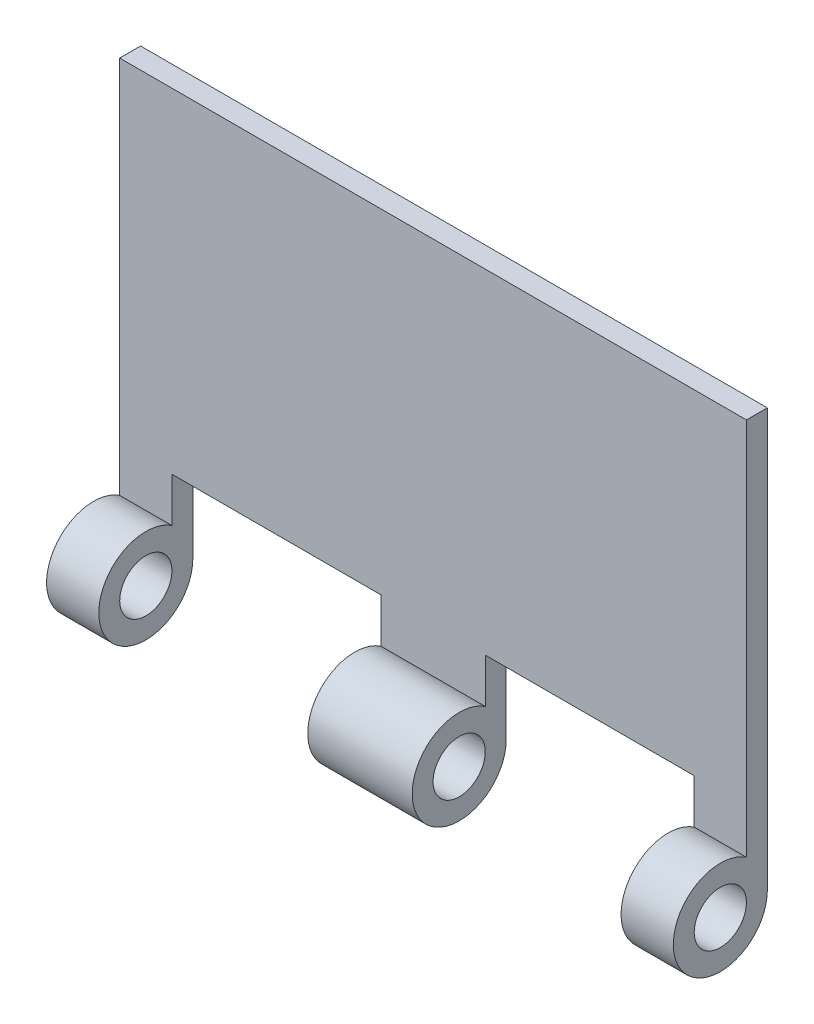
from build123d import *

# Parameters (mm, degrees)
SKETCH1_W           = 76.2
SKETCH1_H           = 50.8
BOSS_EXTRUDE1_DEPTH = 2.54
SKETCH2_R           = 5.715
SKETCH2_R_2         = 3.175
BOSS_EXTRUDE2_DEPTH = 76.2
SKETCH3_W           = 25.4
SKETCH3_H           = 25.4
CUT_EXTRUDE1_DEPTH  = 93.291521279


with BuildPart() as part:
    # Sketch1 → Boss-Extrude1 (new body)
    with BuildSketch(Plane.XY):
        with Locations((-38.1, 25.4)):
            Rectangle(SKETCH1_W, SKETCH1_H)
    extrude(amount=BOSS_EXTRUDE1_DEPTH)

    # Sketch2 → Boss-Extrude2 (add)
    with BuildSketch(Plane.ZY.offset(76.2)):
        with Locations((5.715, 0)):
            Circle(SKETCH2_R)
        with Locations((5.715, 0)):
            Circle(SKETCH2_R_2, mode=Mode.SUBTRACT)
    extrude(amount=-BOSS_EXTRUDE2_DEPTH)

    # Sketch3 → Cut-Extrude1 (cut, through all)
    with BuildSketch(Plane(origin=(0, 0, 0), x_dir=(-1, 0, 0), z_dir=(0, 0, -1))):
        with Locations((19.05, -2.54)):
            Rectangle(SKETCH3_W, SKETCH3_H)
        with Locations((57.15, -2.54)):
            Rectangle(SKETCH3_W, SKETCH3_H)
    extrude(amount=-CUT_EXTRUDE1_DEPTH, mode=Mode.SUBTRACT)


solid = part.part
